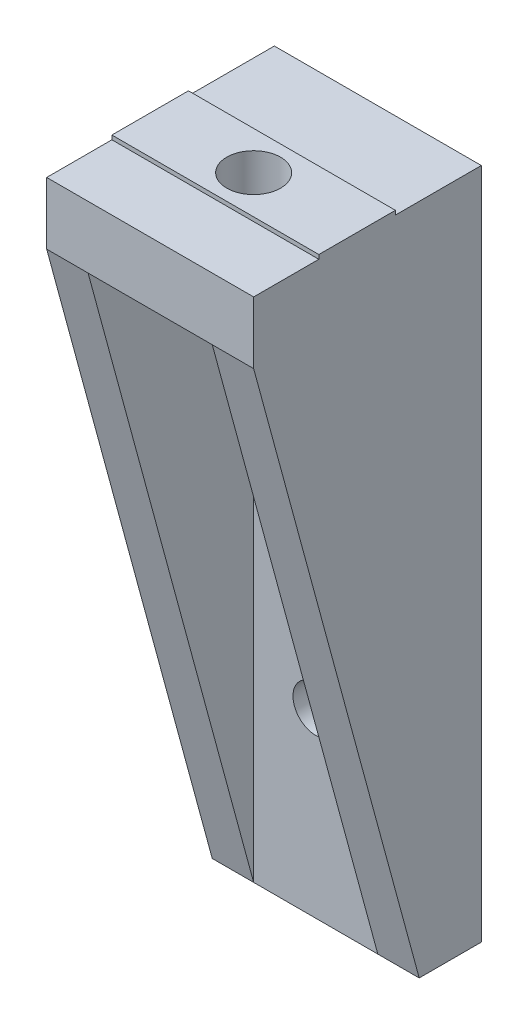
from build123d import *

# Parameters (mm, degrees)
SKETCH_3_W          = 20
SKETCH_3_H          = 59
EXTRUDE_2_DEPTH     = 6
SKETCH_10_R         = 2.2
CUT_EXTRUDE_3_DEPTH = 61.141499815
SKETCH_11_W         = 20
SKETCH_11_H         = 22
EXTRUDE_5_DEPTH     = 6
SKETCH_9_W          = 20
SKETCH_9_H          = 7.4
EXTRUDE_4_DEPTH     = 0.4
SKETCH_13_R         = 2.6
CUT_EXTRUDE_4_DEPTH = 70.722019477
EXTRUDE_6_DEPTH     = 4


with BuildPart() as part:
    # Эскиз3 → Бобышка-Вытянуть2 (new body)
    with BuildSketch(Plane.XY):
        with Locations((0, 29.5)):
            Rectangle(SKETCH_3_W, SKETCH_3_H)
    extrude(amount=EXTRUDE_2_DEPTH)

    # Эскиз10 → Вырез-Вытянуть3 (cut, through all)
    with BuildSketch(Plane(origin=(0, 0, 0), x_dir=(-1, 0, 0), z_dir=(0, 0, -1))):
        with Locations((0, 17.5)):
            Circle(SKETCH_10_R)
    extrude(amount=-CUT_EXTRUDE_3_DEPTH, mode=Mode.SUBTRACT)

    # Эскиз11 → Бобышка-Вытянуть5 (add)
    with BuildSketch(Plane(origin=(0, 59, 0), x_dir=(1, 0, 0), z_dir=(0, 1, 0))):
        with Locations((0, -11)):
            Rectangle(SKETCH_11_W, SKETCH_11_H)
    extrude(amount=EXTRUDE_5_DEPTH)

    # Эскиз9 → Бобышка-Вытянуть4 (add)
    with BuildSketch(Plane(origin=(0, 65, -43.4), x_dir=(1, 0, 0), z_dir=(0, -1, 0))):
        with Locations((0, 55.4)):
            Rectangle(SKETCH_9_W, SKETCH_9_H)
    extrude(amount=-EXTRUDE_4_DEPTH)

    # Эскиз13 → Вырез-Вытянуть4 (cut, through all)
    with BuildSketch(Plane(origin=(0, 65.4, 0), x_dir=(1, 0, 0), z_dir=(0, 1, 0))):
        with Locations(Location((0, -12, 0), (0, 0, 270))):
            Circle(SKETCH_13_R)
    extrude(amount=-CUT_EXTRUDE_4_DEPTH, mode=Mode.SUBTRACT)

    # Эскиз17 → Бобышка-Вытянуть6 (add)
    with BuildSketch(Plane.ZY.offset(10)):
        Polygon((22, 59), (6, 59), (6, 0), align=None)
    extrude_6 = extrude(amount=-EXTRUDE_6_DEPTH)

    # Зеркальное отражение1: Бобышка-Вытянуть6 across plane
    add(extrude_6.mirror(Plane(origin=(0, 0, 0), x_dir=(0, 0, 1), z_dir=(1, 0, 0))))


solid = part.part
